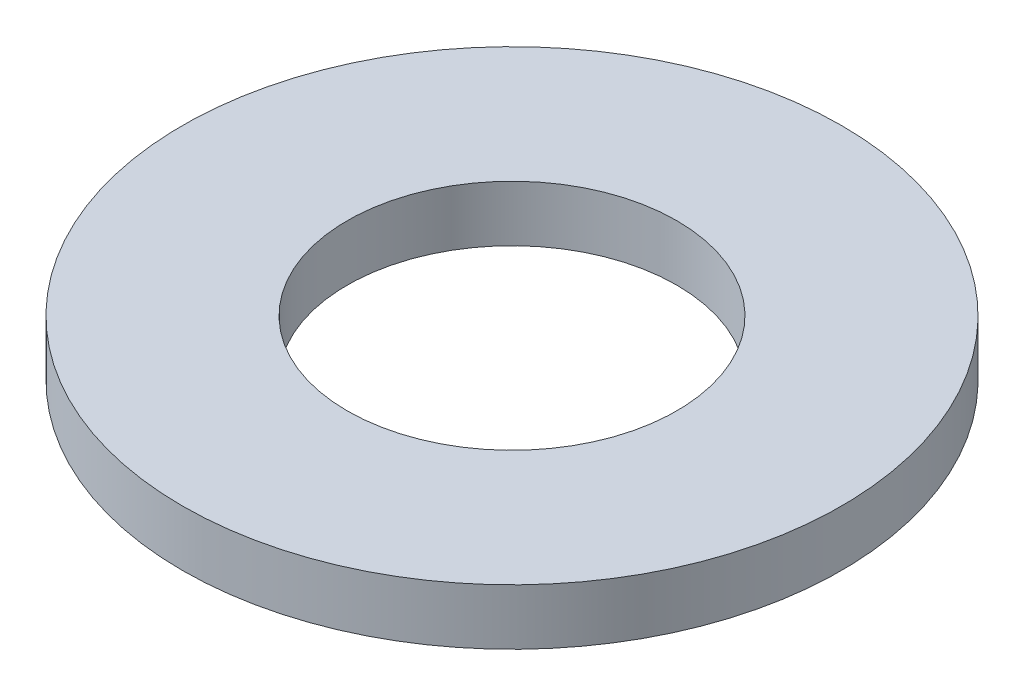
from build123d import *

# Parameters (mm, degrees)
SKETCH_1_R      = 59
SKETCH_1_R_2    = 29.5
EXTRUDE_1_DEPTH = 10


with BuildPart() as part:
    # Эскиз1 → Бобышка-Вытянуть1 (new body)
    with BuildSketch(Plane(origin=(0, 0, 0), x_dir=(1, 0, 0), z_dir=(0, 1, 0))):
        with Locations(Location((0, 0, 0), (0, 0, 270))):
            Circle(SKETCH_1_R)
        with Locations(Location((0, 0, 0), (0, 0, 270))):
            Circle(SKETCH_1_R_2, mode=Mode.SUBTRACT)
    extrude(amount=EXTRUDE_1_DEPTH)


solid = part.part
